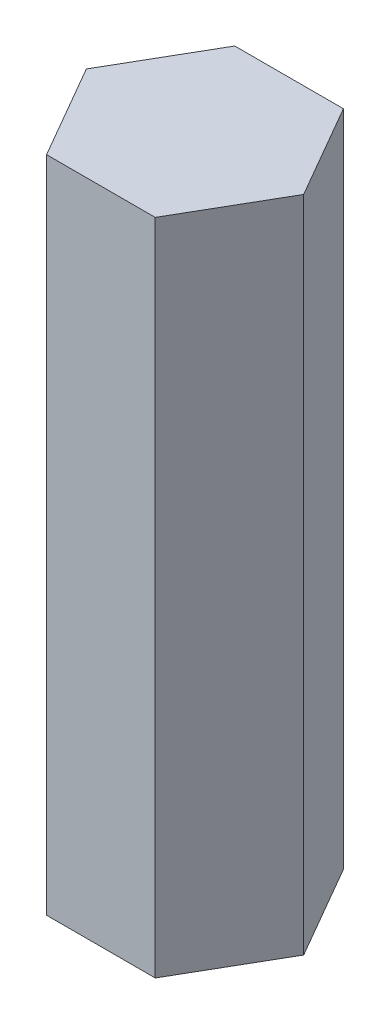
from build123d import *

# Parameters (mm, degrees)
BOSS_EXTRU_1_DEPTH = 70


with BuildPart() as part:
    # Esquisse1 → Boss.-Extru.1 (new body)
    with BuildSketch(Plane(origin=(0, 0, 0), x_dir=(1, 0, 0), z_dir=(0, 1, 0))):
        Polygon((0, 10), (-5.773502692, 20), (-17.320508076, 20), (-23.094010768, 10), (-17.320508076, 0), (-5.773502692, 0), align=None)
    extrude(amount=BOSS_EXTRU_1_DEPTH)


solid = part.part
